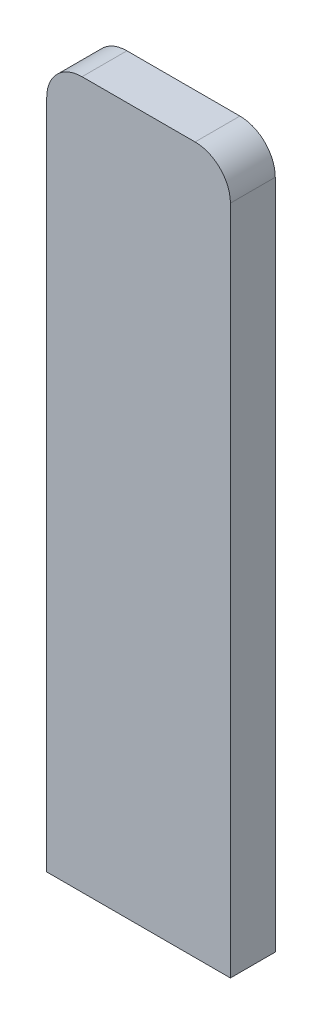
from build123d import *

# Parameters (mm, degrees)
BOSS_EXTRUDE1_DEPTH = 6.35


with BuildPart() as part:
    # Sketch1 → Boss-Extrude1 (new body)
    with BuildSketch(Plane(origin=(0, 0, 7.302957559), x_dir=(-1, 0, 0), z_dir=(0, 0, -1))):
        with BuildLine():
            Line((1.325270249, -21.25067002), (27.325270249, -21.25067002))
            Line((27.325270249, -21.25067002), (27.325270249, 73.74932998))
            ThreePointArc((27.325270249, 73.74932998), (25.860804155, 77.284863886), (22.325270249, 78.74932998))
            Line((22.325270249, 78.74932998), (6.325270249, 78.74932998))
            ThreePointArc((6.325270249, 78.74932998), (2.789736343, 77.284863886), (1.325270249, 73.74932998))
            Line((1.325270249, 73.74932998), (1.325270249, -21.25067002))
        make_face()
    extrude(amount=BOSS_EXTRUDE1_DEPTH)


solid = part.part
